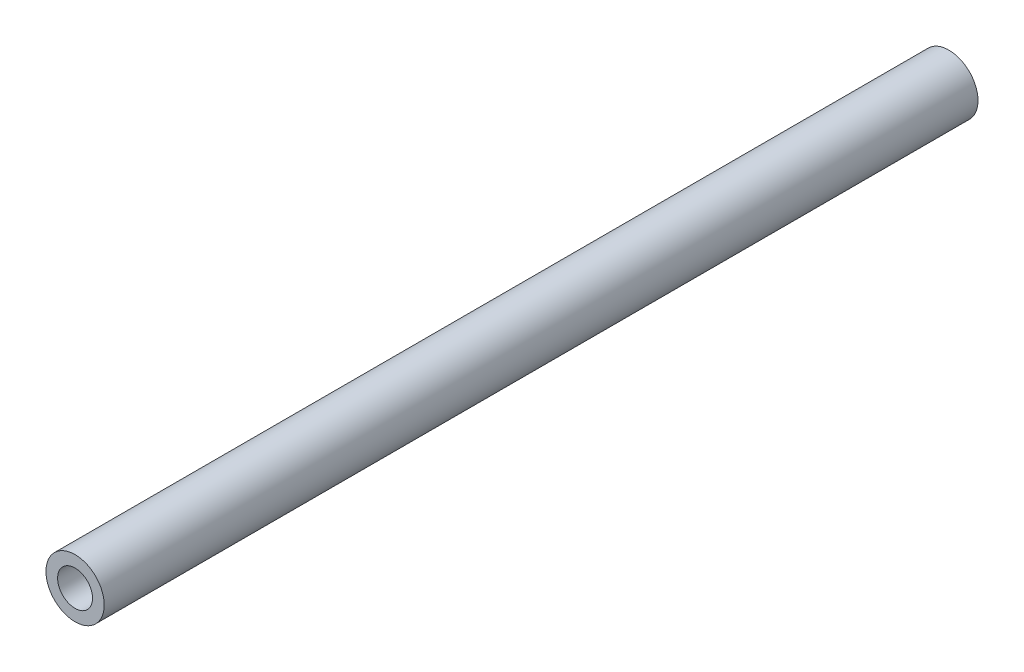
from build123d import *

# Parameters (mm, degrees)
SKETCH_1_R      = 2.5
SKETCH_1_R_2    = 1.5
EXTRUDE_1_DEPTH = 37.5


with BuildPart() as part:
    # 草图1 → 凸台-拉伸1 (new, symmetric)
    with BuildSketch(Plane.XY):
        Circle(SKETCH_1_R)
        Circle(SKETCH_1_R_2, mode=Mode.SUBTRACT)
    extrude(amount=EXTRUDE_1_DEPTH, both=True)


solid = part.part
